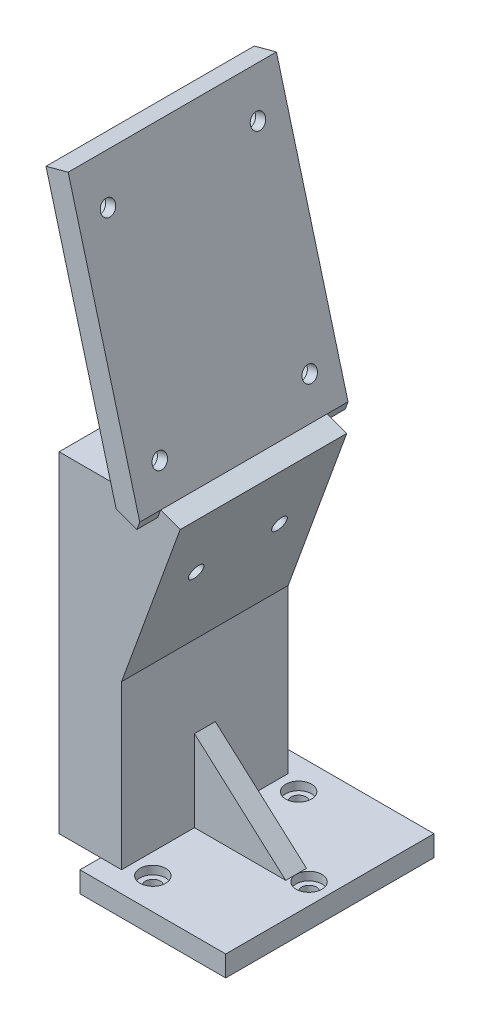
from build123d import *

# Parameters (mm, degrees)
SKETCH_2_W           = 5
SKETCH_2_H           = 40
CUT_EXTRUDE_1_REACH  = 90.301
SKETCH_3_R           = 1.8
SKETCH_6_W           = 30
SKETCH_6_H           = 40
EXTRUDE_1_DEPTH      = 5
CUT_EXTRUDE_2_REACH  = 95.593
SKETCH_8_R           = 1.8
SKETCH_9_W           = 35
SKETCH_9_H           = 5
EXTRUDE_2_DEPTH      = 5
SKETCH_10_R          = 3.1
CUT_EXTRUDE_3_DEPTH  = 2
SKETCH_11_R          = 3.1
CUT_EXTRUDE_4_DEPTH  = 2
EXTRUDE_4_DEPTH      = 3
EXTRUDE_5_DEPTH      = 25
EXTRUDE_5_DEPTH_BACK = 25
CUT_EXTRUDE_5_REACH  = 150.427
SKETCH_17_R          = 1.8
SKETCH_18_R          = 3.5
CUT_EXTRUDE_6_DEPTH  = 3
EXTRUDE_6_DEPTH      = 34
RIB_4_REACH          = 156.717
SKETCH_20_WALL_W     = 374.245878862
SKETCH_20_WALL_H     = 5
RIB_5_REACH          = 156.717
SKETCH_21_WALL_W     = 340.795986182
SKETCH_21_WALL_H     = 5


with BuildPart() as part:
    # 扫描1: sweep along a path in 草图1
    with BuildLine(Plane.XY) as sweep_1_path:
        Line((0, 0), (0, 45))
        Line((0, 45), (14.36484602, 84.467090073))
    # 草图2 → 扫描1 (sweep)
    with BuildSketch(Plane(origin=(0, 0, 0), x_dir=(1, 0, 0), z_dir=(0, 1, 0))):
        with Locations((2.5, 0)):
            Rectangle(SKETCH_2_W, SKETCH_2_H)
    sweep(path=sweep_1_path.line, transition=Transition.RIGHT)

    # 草图3 → 切除-拉伸1 (cut, up to next)
    with BuildSketch(Plane(origin=(-14.462721218, 5.26400003, 0), x_dir=(0, 0, 1), z_dir=(-0.9396926207859081, 0.3420201433256695, 0)), mode=Mode.PRIVATE) as cut_extrude_1_sk1:
        with Locations(Location((-10, 66.286167935, 0), (0, 0, 270))):
            Circle(SKETCH_3_R)
    cut_extrude_1_tool1 = extrude(cut_extrude_1_sk1.sketch, amount=-CUT_EXTRUDE_1_REACH, mode=Mode.PRIVATE) & part.part
    # 草图3 → 切除-拉伸1 (cut, up to next)
    with BuildSketch(Plane(origin=(-14.462721218, 5.26400003, 0), x_dir=(0, 0, 1), z_dir=(-0.9396926207859081, 0.3420201433256695, 0)), mode=Mode.PRIVATE) as cut_extrude_1_sk2:
        with Locations(Location((10, 66.286167935, 0), (0, 0, 270))):
            Circle(SKETCH_3_R)
    cut_extrude_1_tool2 = extrude(cut_extrude_1_sk2.sketch, amount=-CUT_EXTRUDE_1_REACH, mode=Mode.PRIVATE) & part.part
    add(cut_extrude_1_tool1.solids().sort_by_distance((8.208483, 67.552623, -10))[0], mode=Mode.SUBTRACT)
    add(cut_extrude_1_tool2.solids().sort_by_distance((8.208483, 67.552623, 10))[0], mode=Mode.SUBTRACT)

    # 草图6 → 凸台-拉伸1 (add)
    with BuildSketch(Plane.XZ):
        with Locations((20, 0)):
            Rectangle(SKETCH_6_W, SKETCH_6_H)
    extrude(amount=-EXTRUDE_1_DEPTH)

    # 草图8 → 切除-拉伸2 (cut, up to next)
    with BuildSketch(Plane.XZ, mode=Mode.PRIVATE) as cut_extrude_2_sk1:
        with Locations(Location((10, 17.5, 0), (0, 0, 270))):
            Circle(SKETCH_8_R)
    cut_extrude_2_tool1 = extrude(cut_extrude_2_sk1.sketch, amount=-CUT_EXTRUDE_2_REACH, mode=Mode.PRIVATE) & part.part
    # 草图8 → 切除-拉伸2 (cut, up to next)
    with BuildSketch(Plane.XZ, mode=Mode.PRIVATE) as cut_extrude_2_sk2:
        with Locations(Location((10, -17.5, 0), (0, 0, 270))):
            Circle(SKETCH_8_R)
    cut_extrude_2_tool2 = extrude(cut_extrude_2_sk2.sketch, amount=-CUT_EXTRUDE_2_REACH, mode=Mode.PRIVATE) & part.part
    # 草图8 → 切除-拉伸2 (cut, up to next)
    with BuildSketch(Plane.XZ, mode=Mode.PRIVATE) as cut_extrude_2_sk3:
        with Locations(Location((30, 0, 0), (0, 0, 270))):
            Circle(SKETCH_8_R)
    cut_extrude_2_tool3 = extrude(cut_extrude_2_sk3.sketch, amount=-CUT_EXTRUDE_2_REACH, mode=Mode.PRIVATE) & part.part
    add(cut_extrude_2_tool1.solids().sort_by_distance((10, 0, 17.5))[0], mode=Mode.SUBTRACT)
    add(cut_extrude_2_tool2.solids().sort_by_distance((10, 0, -17.5))[0], mode=Mode.SUBTRACT)
    add(cut_extrude_2_tool3.solids().sort_by_distance((30, 0, 0))[0], mode=Mode.SUBTRACT)

    # 草图9 → 凸台-拉伸2 (add)
    with BuildSketch(Plane.XZ):
        with Locations((17.5, 22.5)):
            Rectangle(SKETCH_9_W, SKETCH_9_H)
        with Locations((17.5, -22.5)):
            Rectangle(SKETCH_9_W, SKETCH_9_H)
    extrude(amount=-EXTRUDE_2_DEPTH)

    # 草图10 → 切除-拉伸3 (cut)
    with BuildSketch(Plane(origin=(0, 5, 0), x_dir=(1, 0, 0), z_dir=(0, 1, 0))):
        with Locations(Location((10, -17.5, 0), (0, 0, 270))):
            Circle(SKETCH_10_R)
        with Locations(Location((10, 17.5, 0), (0, 0, 270))):
            Circle(SKETCH_10_R)
        with Locations(Location((30, 0, 0), (0, 0, 270))):
            Circle(SKETCH_10_R)
    extrude(amount=-CUT_EXTRUDE_3_DEPTH, mode=Mode.SUBTRACT)

    # 草图11 → 切除-拉伸4 (cut)
    with BuildSketch(Plane(origin=(-14.462721218, 5.26400003, 0), x_dir=(0, 0, 1), z_dir=(-0.9396926207859081, 0.3420201433256695, 0))):
        with Locations(Location((-10, 66.286167935, 0), (0, 0, 270))):
            Circle(SKETCH_11_R)
        with Locations(Location((10, 66.286167935, 0), (0, 0, 270))):
            Circle(SKETCH_11_R)
    extrude(amount=-CUT_EXTRUDE_4_DEPTH, mode=Mode.SUBTRACT)

    # 草图15 → 凸台-拉伸4 (add)
    with BuildSketch(Plane(origin=(0, 0, -20), x_dir=(-1, 0, 0), z_dir=(0, 0, -1))):
        Polygon((-8.680805733, 84.407556003), (-13.680805733, 82.587704831), (0, 45), (0, 5), (10, 5), (10, 84.407556003), align=None)
    extrude_4 = extrude(amount=-EXTRUDE_4_DEPTH)

    # 镜向2: 凸台-拉伸4 across plane
    add(extrude_4.mirror(Plane(origin=(0, 0, 0), x_dir=(1, 0, 0), z_dir=(0, 0, -1))))

    # 草图16 → 凸台-拉伸5 (add, two sides: drawn at the far end of the back side and taken through both)
    with BuildSketch(Plane(origin=(0, 0, 0), x_dir=(-1, 0, 0), z_dir=(0, 0, -1)).offset(-EXTRUDE_5_DEPTH_BACK)):
        Polygon((-14.36484602, 84.467090073), (2.824266896, 148.61773281), (8.142432199, 147.192734712), (-8.680805733, 84.407556003), (-13.680805733, 82.587704831), align=None)
    extrude(amount=EXTRUDE_5_DEPTH + EXTRUDE_5_DEPTH_BACK)

    # 草图17 → 切除-拉伸5 (cut, up to next)
    with BuildSketch(Plane(origin=(34.519356315, 9.249433648, 0), x_dir=(0, 0, -1), z_dir=(0.9659258262890672, 0.2588190451025248, 0)), mode=Mode.PRIVATE) as cut_extrude_5_sk1:
        with Locations(Location((-18, 134.371048043, 0), (0, 0, 90))):
            Circle(SKETCH_17_R)
    cut_extrude_5_tool1 = extrude(cut_extrude_5_sk1.sketch, amount=-CUT_EXTRUDE_5_REACH, mode=Mode.PRIVATE) & part.part
    # 草图17 → 切除-拉伸5 (cut, up to next)
    with BuildSketch(Plane(origin=(34.519356315, 9.249433648, 0), x_dir=(0, 0, -1), z_dir=(0.9659258262890672, 0.2588190451025248, 0)), mode=Mode.PRIVATE) as cut_extrude_5_sk2:
        with Locations(Location((18, 134.371048043, 0), (0, 0, 90))):
            Circle(SKETCH_17_R)
    cut_extrude_5_tool2 = extrude(cut_extrude_5_sk2.sketch, amount=-CUT_EXTRUDE_5_REACH, mode=Mode.PRIVATE) & part.part
    # 草图17 → 切除-拉伸5 (cut, up to next)
    with BuildSketch(Plane(origin=(34.519356315, 9.249433648, 0), x_dir=(0, 0, -1), z_dir=(0.9659258262890672, 0.2588190451025248, 0)), mode=Mode.PRIVATE) as cut_extrude_5_sk3:
        with Locations(Location((18, 86.371048043, 0), (0, 0, 90))):
            Circle(SKETCH_17_R)
    cut_extrude_5_tool3 = extrude(cut_extrude_5_sk3.sketch, amount=-CUT_EXTRUDE_5_REACH, mode=Mode.PRIVATE) & part.part
    # 草图17 → 切除-拉伸5 (cut, up to next)
    with BuildSketch(Plane(origin=(34.519356315, 9.249433648, 0), x_dir=(0, 0, -1), z_dir=(0.9659258262890672, 0.2588190451025248, 0)), mode=Mode.PRIVATE) as cut_extrude_5_sk4:
        with Locations(Location((-18, 86.371048043, 0), (0, 0, 90))):
            Circle(SKETCH_17_R)
    cut_extrude_5_tool4 = extrude(cut_extrude_5_sk4.sketch, amount=-CUT_EXTRUDE_5_REACH, mode=Mode.PRIVATE) & part.part
    add(cut_extrude_5_tool1.solids().sort_by_distance((-0.25843, 139.041899, 18))[0], mode=Mode.SUBTRACT)
    add(cut_extrude_5_tool2.solids().sort_by_distance((-0.25843, 139.041899, -18))[0], mode=Mode.SUBTRACT)
    add(cut_extrude_5_tool3.solids().sort_by_distance((12.164884, 92.67746, -18))[0], mode=Mode.SUBTRACT)
    add(cut_extrude_5_tool4.solids().sort_by_distance((12.164884, 92.67746, 18))[0], mode=Mode.SUBTRACT)

    # 草图18 → 切除-拉伸6 (cut)
    with BuildSketch(Plane(origin=(29.201191012, 7.82443555, 0), x_dir=(0, 0, 1), z_dir=(-0.9659258262890674, -0.2588190451025246, 0))):
        with Locations(Location((-18, 134.371048043, 0), (0, 0, 270))):
            Circle(SKETCH_18_R)
        with Locations(Location((18, 134.371048043, 0), (0, 0, 270))):
            Circle(SKETCH_18_R)
        with Locations(Location((18, 86.371048043, 0), (0, 0, 270))):
            Circle(SKETCH_18_R)
        with Locations(Location((-18, 86.371048043, 0), (0, 0, 270))):
            Circle(SKETCH_18_R)
    extrude(amount=-CUT_EXTRUDE_6_DEPTH, mode=Mode.SUBTRACT)

    # 草图19 → 凸台-拉伸6 (add)
    with BuildSketch(Plane.XY.offset(-17)):
        Polygon((12.654745303, 79.768626969), (8.151824791, 81.407556003), (-10, 81.407556003), (-10, 84.407556003), (8.680805733, 84.407556003), (13.680805733, 82.587704831), align=None)
    extrude(amount=EXTRUDE_6_DEPTH)

    # 草图20 wall → 筋4 (add, up to next)
    with BuildSketch(Plane(origin=(-9.071216099, 115.800145357, 0), x_dir=(0.029573147262, 0.999562618829, 0), z_dir=(0.999562618829, -0.029573147262, 0)), mode=Mode.PRIVATE) as rib_4_sk1:
        Rectangle(SKETCH_20_WALL_W, SKETCH_20_WALL_H)
    rib_4_tool1 = extrude(rib_4_sk1.sketch, amount=RIB_4_REACH, mode=Mode.PRIVATE) - part.part
    add(rib_4_tool1.solids().sort_by_distance((-9.071216099, 115.800145357, 0))[0])

    # 草图21 wall → 筋5 (add, up to next)
    with BuildSketch(Plane(origin=(15.95, 14.779591274, 0), x_dir=(0.745842716131, -0.666122093009, 0), z_dir=(-0.666122093009, -0.745842716131, 0)), mode=Mode.PRIVATE) as rib_5_sk1:
        Rectangle(SKETCH_21_WALL_W, SKETCH_21_WALL_H)
    rib_5_tool1 = extrude(rib_5_sk1.sketch, amount=RIB_5_REACH, mode=Mode.PRIVATE) - part.part
    add(rib_5_tool1.solids().sort_by_distance((15.95, 14.779591274, 0))[0])


solid = part.part
